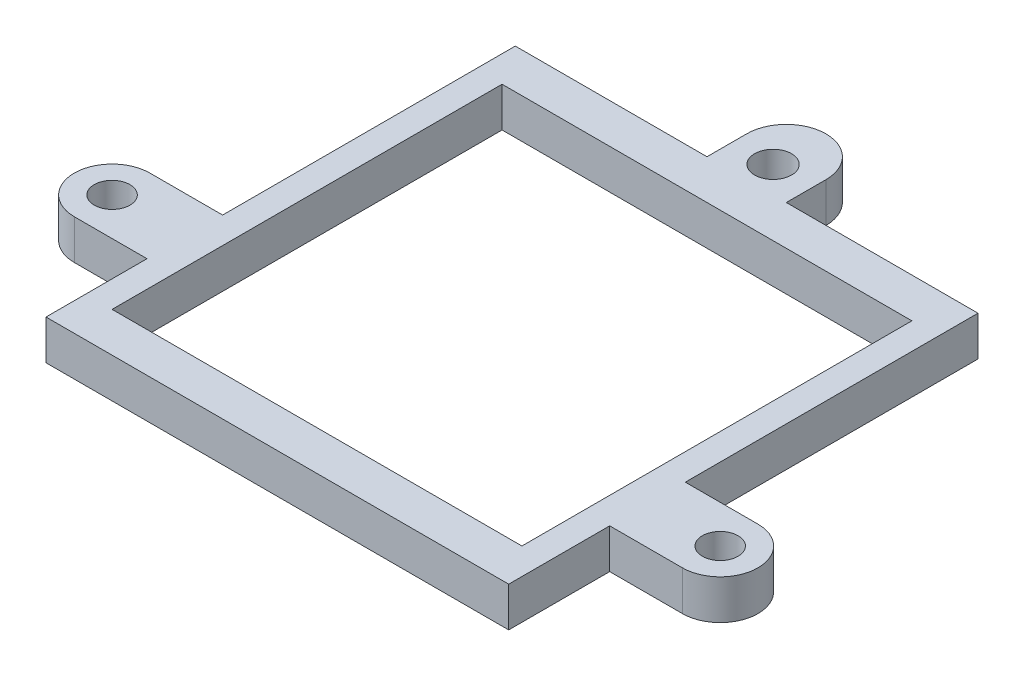
from build123d import *

# Parameters (mm, degrees)
SKETCH1_R           = 1.35
SKETCH1_W           = 35
SKETCH1_H           = 35.5
SKETCH1_W_2         = 31
SKETCH1_H_2         = 29.5
SKETCH1_R_2         = 1.4
BOSS_EXTRUDE3_DEPTH = 3


with BuildPart() as part:
    # Sketch1 → Boss-Extrude3 (new body)
    # profile 1 of 4: a face of its own
    with BuildSketch(Plane(origin=(0, 0, 0), x_dir=(1, 0, 0), z_dir=(0, 1, 0))):
        with BuildLine():
            Line((-17.5, -10.110115741), (-17.5, -4.389884259))
            Line((-17.5, -4.389884259), (-23, -4.389884259))
            ThreePointArc((-23, -4.389884259), (-25.860115741, -7.25), (-23, -10.110115741))
            Line((-23, -10.110115741), (-17.5, -10.110115741))
        make_face()
        with Locations(Location((-23, -7.25, 0), (0, 0, 270))):
            Circle(SKETCH1_R, mode=Mode.SUBTRACT)
    # profile 2 of 4: a face of its own
    with BuildSketch(Plane(origin=(0, 0, 0), x_dir=(1, 0, 0), z_dir=(0, 1, 0))):
        Rectangle(SKETCH1_W, SKETCH1_H)
        Rectangle(SKETCH1_W_2, SKETCH1_H_2, mode=Mode.SUBTRACT)
    # profile 3 of 4: a face of its own
    with BuildSketch(Plane(origin=(0, 0, 0), x_dir=(1, 0, 0), z_dir=(0, 1, 0))):
        with BuildLine():
            Line((23, -4.389884259), (17.5, -4.389884259))
            Line((17.5, -4.389884259), (17.5, -10.110115741))
            Line((17.5, -10.110115741), (23, -10.110115741))
            ThreePointArc((23, -10.110115741), (25.860115741, -7.25), (23, -4.389884259))
        make_face()
        with Locations(Location((23, -7.25, 0), (0, 0, 270))):
            Circle(SKETCH1_R, mode=Mode.SUBTRACT)
    # profile 4 of 4: a face of its own
    with BuildSketch(Plane(origin=(0, 0, 0), x_dir=(1, 0, 0), z_dir=(0, 1, 0))):
        with BuildLine():
            Line((-3, 20.75), (-3, 17.75))
            Line((-3, 17.75), (3, 17.75))
            Line((3, 17.75), (3, 20.75))
            ThreePointArc((3, 20.75), (0, 23.75), (-3, 20.75))
        make_face()
        with Locations(Location((0, 19.75, 0), (0, 0, 270))):
            Circle(SKETCH1_R_2, mode=Mode.SUBTRACT)
    extrude(amount=BOSS_EXTRUDE3_DEPTH)


solid = part.part
